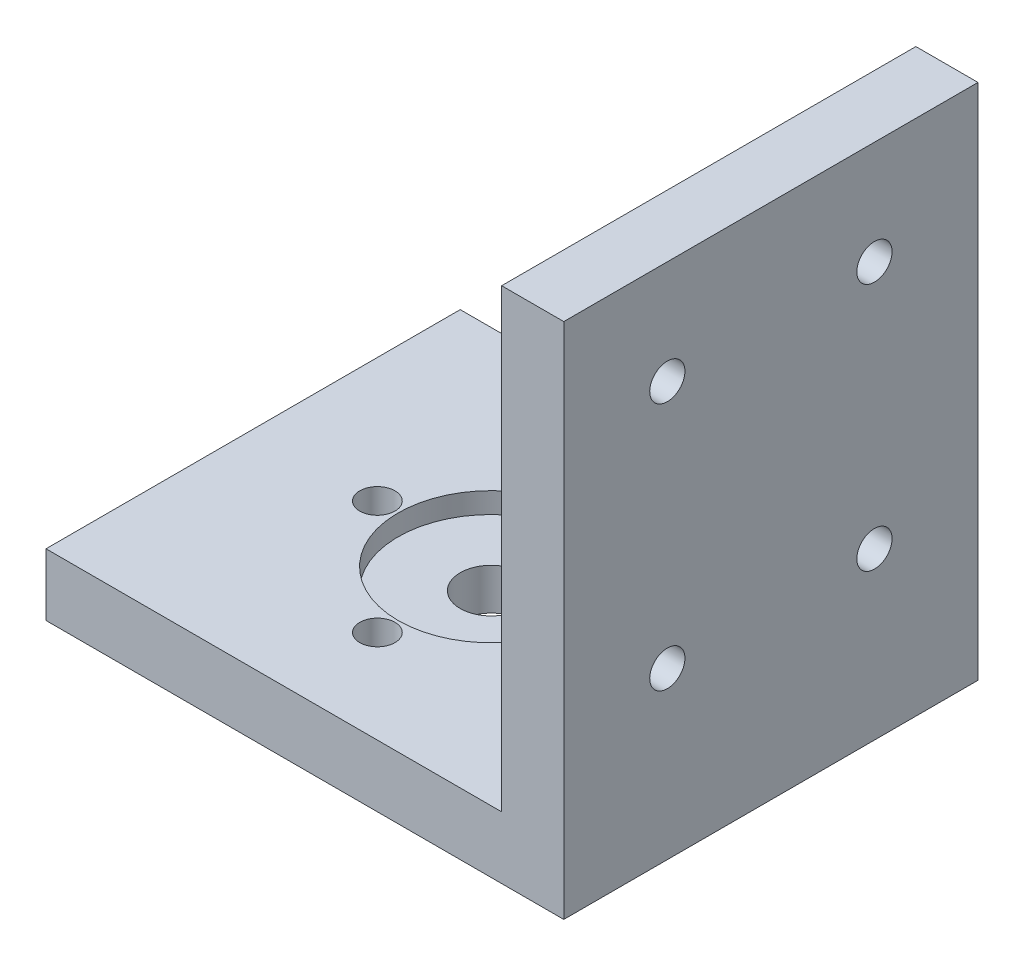
from build123d import *

# Parameters (mm, degrees)
SKETCH1_W           = 50
SKETCH1_H           = 40
BOSS_EXTRUDE1_DEPTH = 50
SKETCH2_W           = 44
SKETCH2_H           = 44
CUT_EXTRUDE1_DEPTH  = 50
SKETCH3_R           = 1.7
CUT_EXTRUDE3_DEPTH  = 78.691698398
SKETCH5_R           = 9
CUT_EXTRUDE4_DEPTH  = 2
SKETCH6_R           = 3
CUT_EXTRUDE5_DEPTH  = 79.841613378
SKETCH7_R           = 1.7
CUT_EXTRUDE6_DEPTH  = 78.691698398


with BuildPart() as part:
    # Sketch1 → Boss-Extrude1 (new body)
    with BuildSketch(Plane(origin=(0, 0, 0), x_dir=(1, 0, 0), z_dir=(0, 1, 0))):
        with Locations((25, 20)):
            Rectangle(SKETCH1_W, SKETCH1_H)
    extrude(amount=BOSS_EXTRUDE1_DEPTH)

    # Sketch2 → Cut-Extrude1 (cut)
    with BuildSketch(Plane.XY):
        with Locations((22, 28)):
            Rectangle(SKETCH2_W, SKETCH2_H)
    extrude(amount=-CUT_EXTRUDE1_DEPTH, mode=Mode.SUBTRACT)

    # Sketch3 → Cut-Extrude3 (cut, through all)
    with BuildSketch(Plane.ZY.offset(-44)):
        with Locations(Location((-30, 40, 0), (0, 0, 270))):
            Circle(SKETCH3_R)
        with Locations(Location((-10, 40, 0), (0, 0, 270))):
            Circle(SKETCH3_R)
        with Locations(Location((-10, 16, 0), (0, 0, 270))):
            Circle(SKETCH3_R)
        with Locations(Location((-30, 16, 0), (0, 0, 270))):
            Circle(SKETCH3_R)
    extrude(amount=-CUT_EXTRUDE3_DEPTH, mode=Mode.SUBTRACT)

    # Sketch5 → Cut-Extrude4 (cut)
    with BuildSketch(Plane(origin=(0, 6, 0), x_dir=(1, 0, 0), z_dir=(0, 1, 0))):
        with Locations(Location((23, 20, 0), (0, 0, 270))):
            Circle(SKETCH5_R)
    extrude(amount=-CUT_EXTRUDE4_DEPTH, mode=Mode.SUBTRACT)

    # Sketch6 → Cut-Extrude5 (cut, through all)
    with BuildSketch(Plane(origin=(0, 4, 0), x_dir=(1, 0, 0), z_dir=(0, 1, 0))):
        with Locations(Location((23, 20, 0), (0, 0, 270))):
            Circle(SKETCH6_R)
    extrude(amount=-CUT_EXTRUDE5_DEPTH, mode=Mode.SUBTRACT)

    # Sketch7 → Cut-Extrude6 (cut, through all)
    with BuildSketch(Plane(origin=(0, 6, 0), x_dir=(1, 0, 0), z_dir=(0, 1, 0))):
        with Locations(Location((12, 20, 0), (0, 0, 270))):
            Circle(SKETCH7_R)
        with Locations(Location((23, 31, 0), (0, 0, 270))):
            Circle(SKETCH7_R)
        with Locations(Location((34, 20, 0), (0, 0, 270))):
            Circle(SKETCH7_R)
        with Locations(Location((23, 9, 0), (0, 0, 270))):
            Circle(SKETCH7_R)
    extrude(amount=-CUT_EXTRUDE6_DEPTH, mode=Mode.SUBTRACT)


solid = part.part
